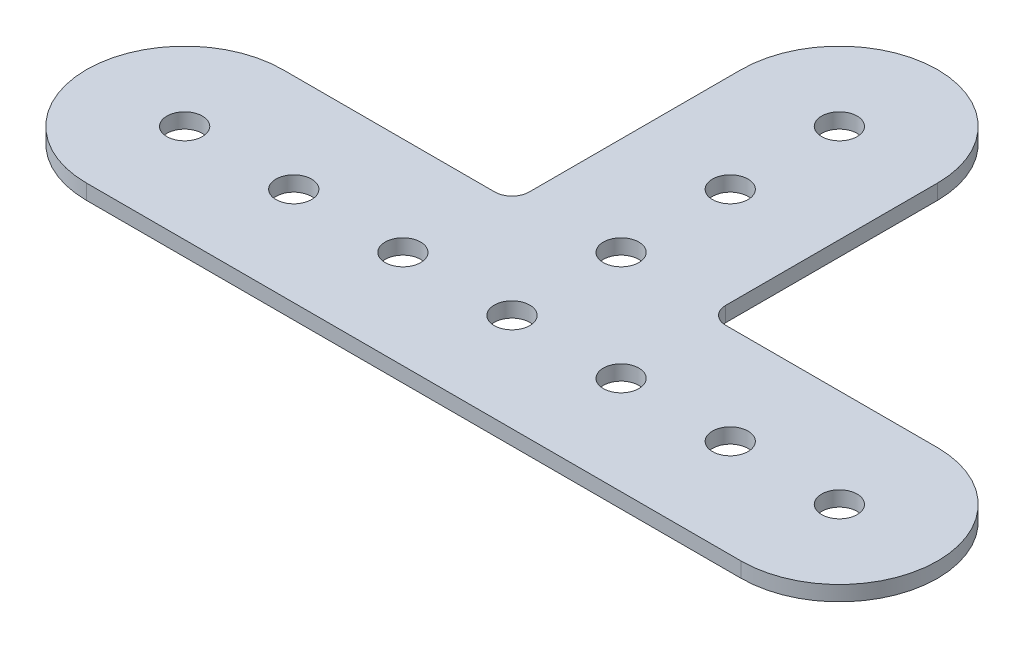
from build123d import *

# Parameters (mm, degrees)
SKETCH1_R           = 2.07
BOSS_EXTRUDE1_DEPTH = 0.875
FILLET1_R           = 2


with BuildPart() as part:
    # Sketch1 → Boss-Extrude1 (new, symmetric)
    with BuildSketch(Plane(origin=(0, 0, 0), x_dir=(1, 0, 0), z_dir=(0, 1, 0))):
        with BuildLine():
            ThreePointArc((-38.1, 11.43), (-49.53, 0), (-38.1, -11.43))
            Line((-38.1, -11.43), (38.1, -11.43))
            ThreePointArc((38.1, -11.43), (49.53, 0), (38.1, 11.43))
            Line((38.1, 11.43), (11.43, 11.43))
            Line((11.43, 11.43), (11.43, 38.1))
            ThreePointArc((11.43, 38.1), (0, 49.53), (-11.43, 38.1))
            Line((-11.43, 38.1), (-11.43, 11.43))
            Line((-11.43, 11.43), (-38.1, 11.43))
        make_face()
        with Locations(Location((-25.4, 0, 0), (0, 0, 270))):
            Circle(SKETCH1_R, mode=Mode.SUBTRACT)
        with Locations(Location((0, 25.4, 0), (0, 0, 270))):
            Circle(SKETCH1_R, mode=Mode.SUBTRACT)
        with Locations(Location((0, 12.7, 0), (0, 0, 270))):
            Circle(SKETCH1_R, mode=Mode.SUBTRACT)
        with Locations(Location((25.4, 0, 0), (0, 0, 270))):
            Circle(SKETCH1_R, mode=Mode.SUBTRACT)
        with Locations(Location((-12.7, 0, 0), (0, 0, 270))):
            Circle(SKETCH1_R, mode=Mode.SUBTRACT)
        with Locations(Location((0, 0, 0), (0, 0, 270))):
            Circle(SKETCH1_R, mode=Mode.SUBTRACT)
        with Locations(Location((12.7, 0, 0), (0, 0, 270))):
            Circle(SKETCH1_R, mode=Mode.SUBTRACT)
        with Locations(Location((-38.1, 0, 0), (0, 0, 270))):
            Circle(SKETCH1_R, mode=Mode.SUBTRACT)
        with Locations(Location((38.1, 0, 0), (0, 0, 270))):
            Circle(SKETCH1_R, mode=Mode.SUBTRACT)
        with Locations(Location((0, 38.1, 0), (0, 0, 270))):
            Circle(SKETCH1_R, mode=Mode.SUBTRACT)
    extrude(amount=BOSS_EXTRUDE1_DEPTH, both=True)

    # Fillet1
    fillet1_edges = [part.edges().sort_by_distance(p)[0] for p in [
        (11.43, 0, -11.43),
        (-11.43, 0, -11.43),
    ]]
    fillet(fillet1_edges, radius=FILLET1_R)


solid = part.part
